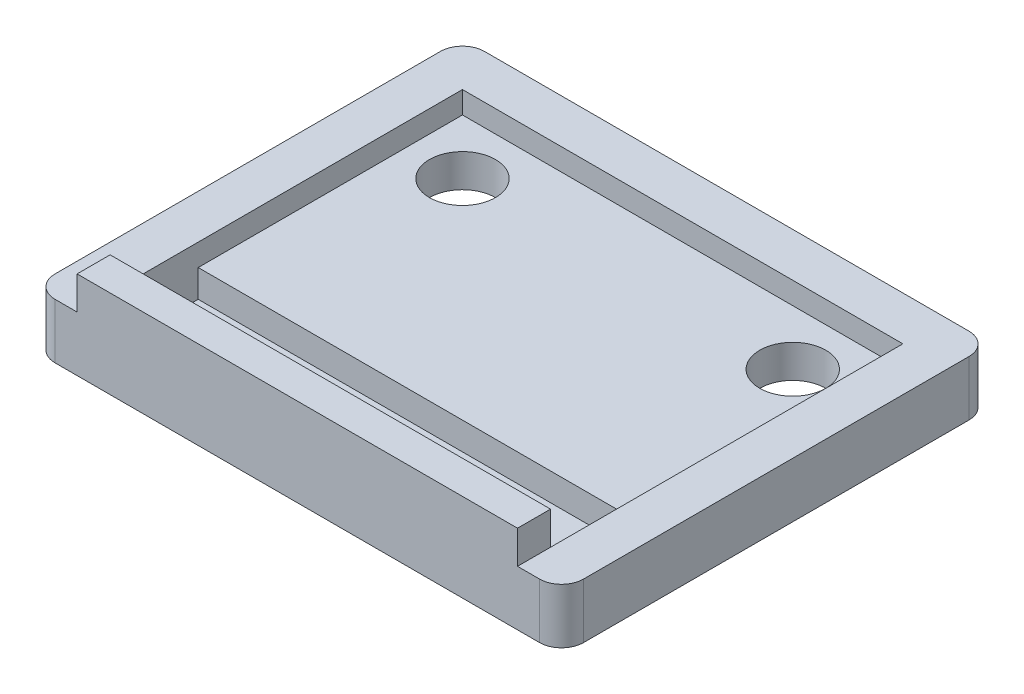
from build123d import *

# Parameters (mm, degrees)
SKETCH3_W           = 20
SKETCH3_H           = 12
SKETCH3_R           = 1.5
BOSS_EXTRUDE2_DEPTH = 1.5
SKETCH3_5_W         = 20
SKETCH3_5_H         = 1.5
BOSS_EXTRUDE4_DEPTH = 4
SKETCH3_6_W         = 20
SKETCH3_6_H         = 4
BOSS_EXTRUDE5_DEPTH = 0.25
BOSS_EXTRUDE7_DEPTH = 2.5


with BuildPart() as part:
    # Sketch3 → Boss-Extrude2 (new body)
    with BuildSketch(Plane(origin=(0, 0, 0), x_dir=(1, 0, 0), z_dir=(0, 1, 0))):
        with Locations((12, 11.5)):
            Rectangle(SKETCH3_W, SKETCH3_H)
        with Locations((19.5, 15)):
            Circle(SKETCH3_R, mode=Mode.SUBTRACT)
        with Locations((4.5, 15)):
            Circle(SKETCH3_R, mode=Mode.SUBTRACT)
    extrude(amount=BOSS_EXTRUDE2_DEPTH)

    # Sketch3<6> → Boss-Extrude5 (add)
    with BuildSketch(Plane(origin=(0, 0, 0), x_dir=(1, 0, 0), z_dir=(0, 1, 0))):
        with Locations((12, 3.5)):
            Rectangle(SKETCH3_6_W, SKETCH3_6_H)
    extrude(amount=BOSS_EXTRUDE5_DEPTH)



with BuildPart() as body_2:
    # Sketch3<5> → Boss-Extrude4 (new body)
    with BuildSketch(Plane(origin=(0, 0, 0), x_dir=(1, 0, 0), z_dir=(0, 1, 0))):
        with Locations((12, 0.75)):
            Rectangle(SKETCH3_5_W, SKETCH3_5_H)
    extrude(amount=BOSS_EXTRUDE4_DEPTH)


with BuildPart() as part_1:
    add(part.part)

    add(body_2.part)  # Boss-Extrude7 merges body 2
    # Sketch3<8> → Boss-Extrude7 (add)
    with BuildSketch(Plane(origin=(0, 0, 0), x_dir=(1, 0, 0), z_dir=(0, 1, 0))):
        with BuildLine():
            ThreePointArc((0, 1), (0.292893219, 0.292893219), (1, 0))
            Line((1, 0), (2, 0))
            Line((2, 0), (2, 1.5))
            Line((2, 1.5), (2, 5.5))
            Line((2, 5.5), (2, 17.5))
            Line((2, 17.5), (22, 17.5))
            Line((22, 17.5), (22, 5.5))
            Line((22, 5.5), (22, 1.5))
            Line((22, 1.5), (22, 0))
            Line((22, 0), (23, 0))
            ThreePointArc((23, 0), (23.707106781, 0.292893219), (24, 1))
            Line((24, 1), (24, 18.5))
            ThreePointArc((24, 18.5), (23.707106781, 19.207106781), (23, 19.5))
            Line((23, 19.5), (1, 19.5))
            ThreePointArc((1, 19.5), (0.292893219, 19.207106781), (0, 18.5))
            Line((0, 18.5), (0, 1))
        make_face()
    extrude(amount=BOSS_EXTRUDE7_DEPTH)


solid = part_1.part
